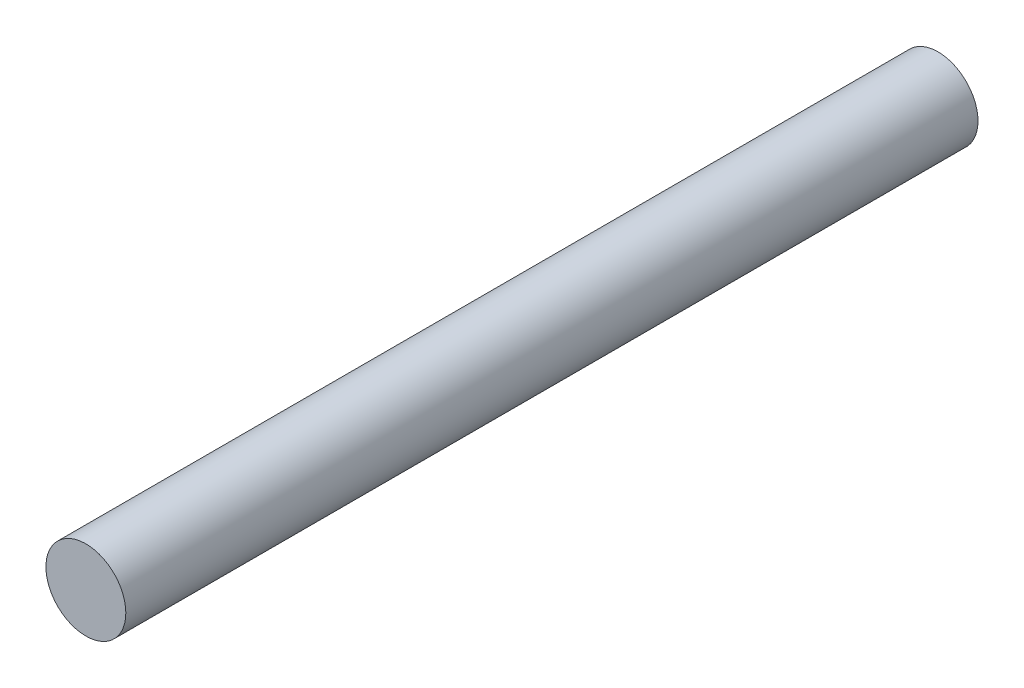
from build123d import *

# Parameters (mm, degrees)
SKETCH1_R           = 0.75
BOSS_EXTRUDE1_DEPTH = 16


with BuildPart() as part:
    # Sketch1 → Boss-Extrude1 (new body)
    with BuildSketch(Plane.XY):
        Circle(SKETCH1_R)
    extrude(amount=BOSS_EXTRUDE1_DEPTH)


solid = part.part
